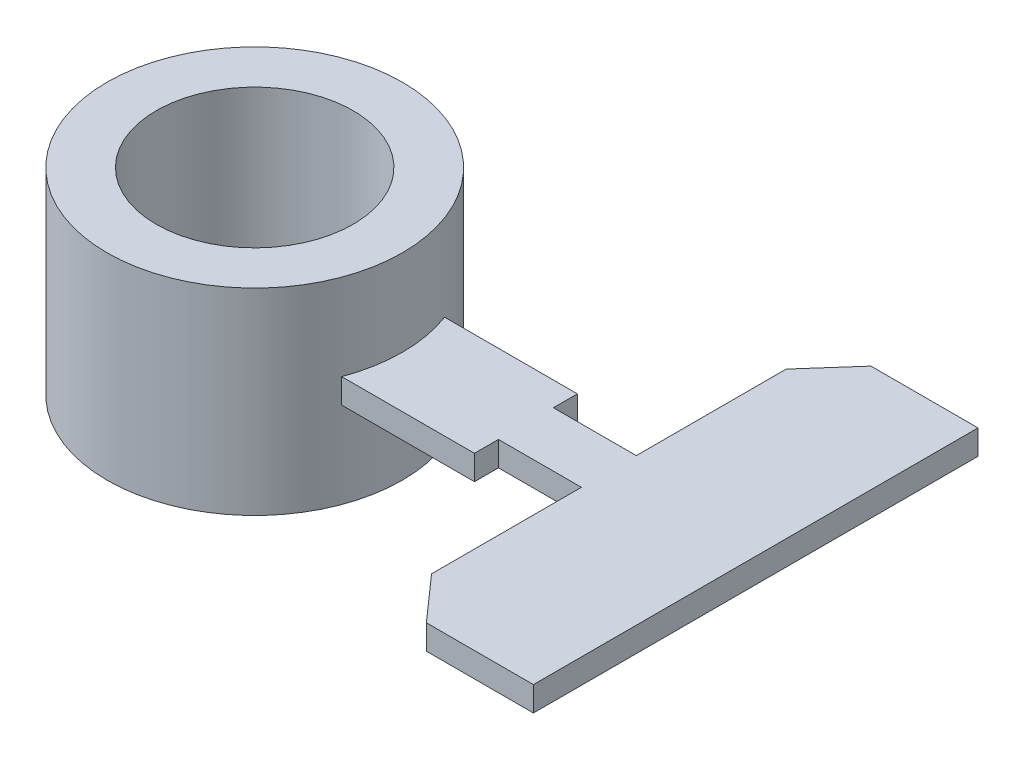
from build123d import *

# Parameters (mm, degrees)
SKETCH1_R           = 30
SKETCH1_R_2         = 20
BOSS_EXTRUDE1_DEPTH = 20
BOSS_EXTRUDE2_DEPTH = 2.5


with BuildPart() as part:
    # Sketch1 → Boss-Extrude1 (new, symmetric)
    with BuildSketch(Plane(origin=(0, 0, 0), x_dir=(1, 0, 0), z_dir=(0, 1, 0))):
        with Locations(Location((0, 0, 0), (0, 0, 270))):
            Circle(SKETCH1_R)
        with Locations(Location((0, 0, 0), (0, 0, 270))):
            Circle(SKETCH1_R_2, mode=Mode.SUBTRACT)
    extrude(amount=BOSS_EXTRUDE1_DEPTH, both=True)

    # Sketch2 → Boss-Extrude2 (add, symmetric)
    with BuildSketch(Plane(origin=(0, 0, 0), x_dir=(1, 0, 0), z_dir=(0, 1, 0))):
        with BuildLine():
            Line((28.120382297, 10.451990215), (55.080308758, 10.451990215))
            Line((55.080308758, 10.451990215), (55.080308758, 5.574382734))
            Line((55.080308758, 5.574382734), (71.919231742, 5.574382734))
            Line((71.919231742, 5.574382734), (71.919231742, 36.006171261))
            Line((71.919231742, 36.006171261), (80.002186763, 45.140832286))
            Line((80.002186763, 45.140832286), (101.742384499, 45.140832286))
            Line((101.742384499, 45.140832286), (101.742384499, -45.140832286))
            Line((101.742384499, -45.140832286), (80.002186763, -45.140832286))
            Line((80.002186763, -45.140832286), (71.919231742, -36.006171261))
            Line((71.919231742, -36.006171261), (71.919231742, -5.574382734))
            Line((71.919231742, -5.574382734), (55.080308758, -5.574382734))
            Line((55.080308758, -5.574382734), (55.080308758, -10.451990215))
            Line((55.080308758, -10.451990215), (28.120382297, -10.451990215))
            ThreePointArc((28.120382297, -10.451990215), (30, 0), (28.120382297, 10.451990215))
        make_face()
    extrude(amount=BOSS_EXTRUDE2_DEPTH, both=True)


solid = part.part
